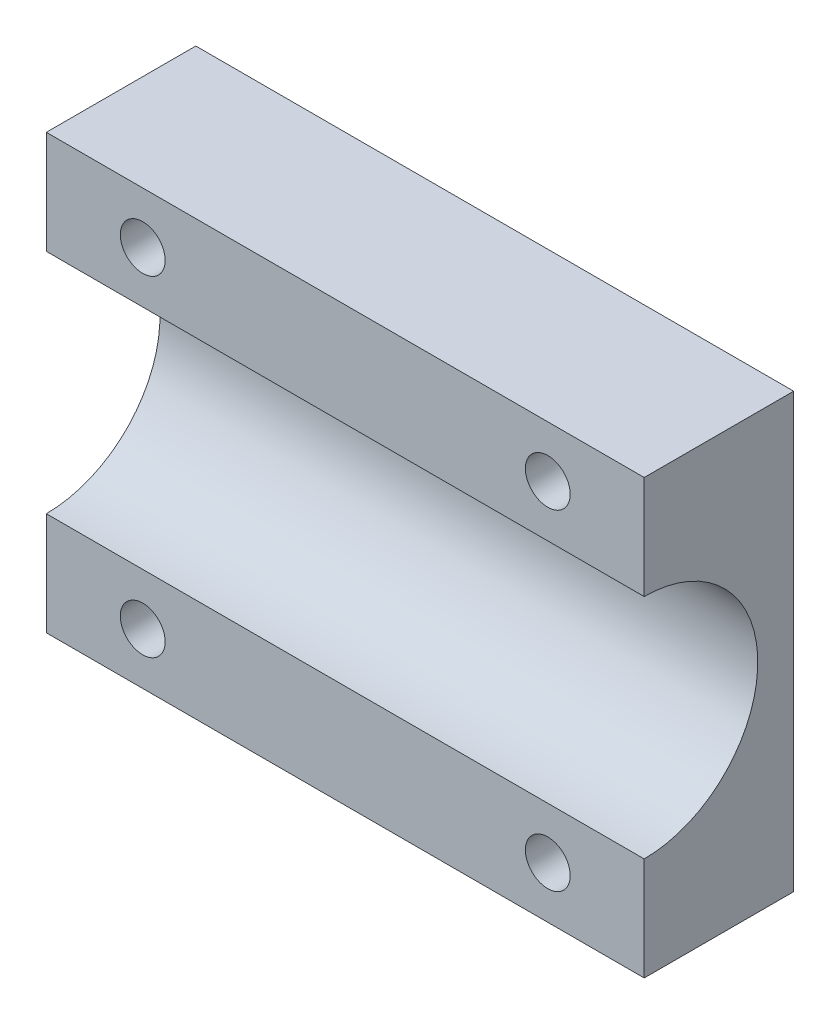
from build123d import *

# Parameters (mm, degrees)
SKETCH1_W           = 29
SKETCH1_H           = 40
BOSS_EXTRUDE1_DEPTH = 10
SKETCH2_R           = 7.6
CUT_EXTRUDE1_DEPTH  = 40
SKETCH3_R           = 1.5
CUT_EXTRUDE2_DEPTH  = 10


with BuildPart() as part:
    # Sketch1 → Boss-Extrude1 (new body)
    with BuildSketch(Plane(origin=(0, 0, 0), x_dir=(0, 1, 0), z_dir=(0, 0, 1))):
        with Locations((14.5, -20)):
            Rectangle(SKETCH1_W, SKETCH1_H)
    extrude(amount=BOSS_EXTRUDE1_DEPTH)

    # Sketch2 → Cut-Extrude1 (cut)
    with BuildSketch(Plane.YZ.offset(40)):
        with Locations((14.5, 10)):
            Circle(SKETCH2_R)
    extrude(amount=-CUT_EXTRUDE1_DEPTH, mode=Mode.SUBTRACT)

    # Sketch3 → Cut-Extrude2 (cut)
    with BuildSketch(Plane.XY.offset(10)):
        with Locations((6.45, 25.55)):
            Circle(SKETCH3_R)
        with Locations((33.55, 25.55)):
            Circle(SKETCH3_R)
        with Locations((33.55, 3.45)):
            Circle(SKETCH3_R)
        with Locations((6.45, 3.45)):
            Circle(SKETCH3_R)
    extrude(amount=-CUT_EXTRUDE2_DEPTH, mode=Mode.SUBTRACT)


solid = part.part
